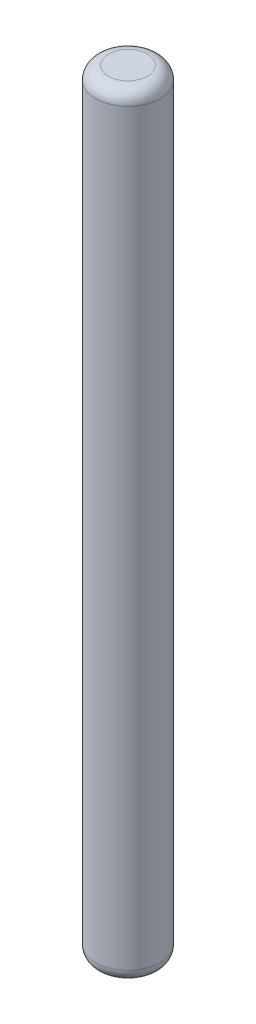
from build123d import *

# Parameters (mm, degrees)
SKETCH_1_R      = 2.5
EXTRUDE_1_DEPTH = 60
FILLET_1_R      = 1


with BuildPart() as part:
    # 草图1 → 凸台-拉伸1 (new body)
    with BuildSketch(Plane(origin=(0, 0, 0), x_dir=(1, 0, 0), z_dir=(0, 1, 0))):
        with Locations(Location((0, 0, 0), (0, 0, 270))):
            Circle(SKETCH_1_R)
    extrude(amount=EXTRUDE_1_DEPTH)

    # 圆角1
    fillet_1_edges = [part.edges().sort_by_distance(p)[0] for p in [
        (0, 0, -2.5),
        (0, 60, -2.5),
    ]]
    fillet(fillet_1_edges, radius=FILLET_1_R)


solid = part.part
